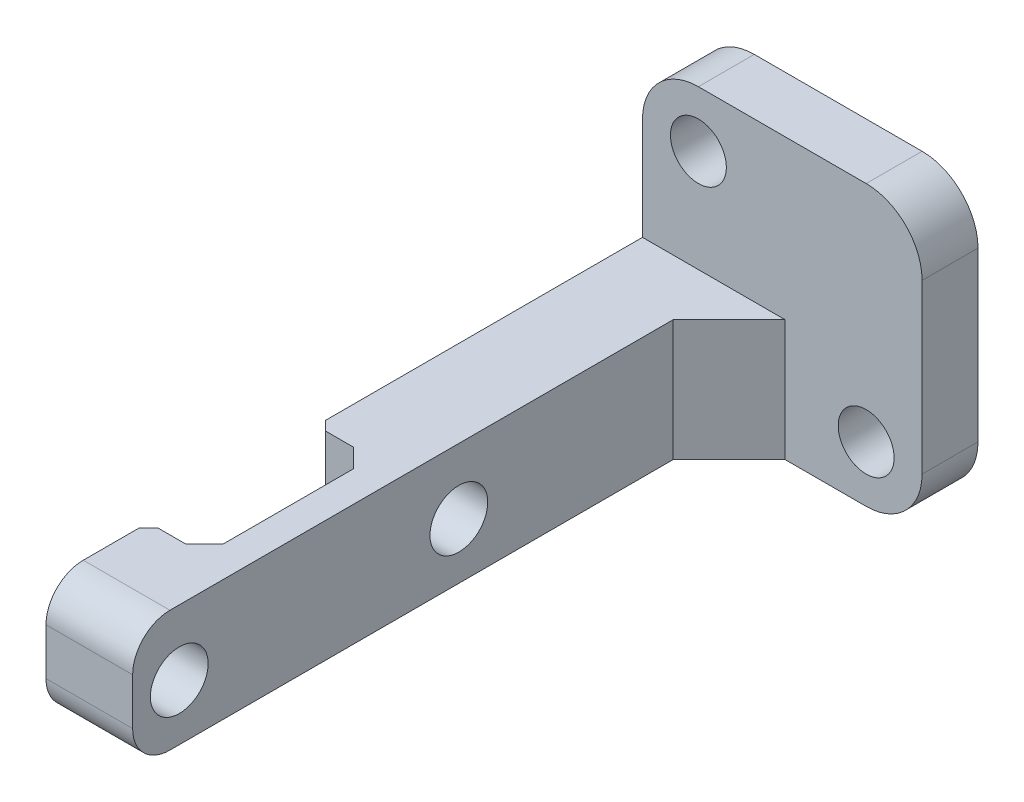
from build123d import *

# Parameters (mm, degrees)
SKETCH1_W           = 28
SKETCH1_H           = 5
BOSS_EXTRUDE1_DEPTH = 20
CHAMFER1_SIZE       = 15
BOSS_EXTRUDE2_DEPTH = 28
SKETCH3_W           = 3
SKETCH3_H           = 9
CUT_EXTRUDE1_DEPTH  = 12.8
CHAMFER2_SIZE       = 1
FILLET1_R           = 2
CHAMFER3_SIZE       = 0.5
CUT_EXTRUDE2_DEPTH  = 12.8
CHAMFER4_SIZE       = 3
CHAMFER5_SIZE       = 3
SKETCH8_W           = 3.20799886
SKETCH8_H           = 3.210000155
SKETCH8_W_2         = 3.209995615
SKETCH8_H_2         = 3.268000248
CUT_EXTRUDE3_DEPTH  = 5.4
SKETCH9_W           = 136.063633216
SKETCH9_H           = 34.178471192
CUT_EXTRUDE4_DEPTH  = 8
SKETCH10_W          = 4.648757297
SKETCH10_H          = 6.5
BOSS_EXTRUDE3_DEPTH = 10
SKETCH12_W          = 15
SKETCH12_H          = 15
BOSS_EXTRUDE4_DEPTH = 3
SKETCH13_R          = 1.5
CUT_EXTRUDE5_DEPTH  = 5
FILLET2_R           = 3
CHAMFER6_SIZE       = 3


with BuildPart() as part:
    # Sketch1 → Boss-Extrude1 (new body)
    with BuildSketch(Plane(origin=(0, 0, 0), x_dir=(1, 0, 0), z_dir=(0, 1, 0))):
        with Locations((14, 2.5)):
            Rectangle(SKETCH1_W, SKETCH1_H)
    extrude(amount=BOSS_EXTRUDE1_DEPTH)

    # Chamfer1
    chamfer1_edges = [part.edges().sort_by_distance(p)[0] for p in [
        (28, 0, -2.5),
    ]]
    chamfer(chamfer1_edges, length=CHAMFER1_SIZE)

    # Sketch2 → Boss-Extrude2 (add)
    with BuildSketch(Plane.XY):
        Polygon((9.648757297, 6.5), (5, 6.5), (5, 2), (5, 0), (9.648757297, 0), align=None)
    extrude(amount=BOSS_EXTRUDE2_DEPTH)

    # Sketch3 → Cut-Extrude1 (cut)
    with BuildSketch(Plane.XZ):
        with Locations((6.5, 18)):
            Rectangle(SKETCH3_W, SKETCH3_H)
    extrude(amount=-CUT_EXTRUDE1_DEPTH, mode=Mode.SUBTRACT)

    # Chamfer2
    chamfer2_edges = [part.edges().sort_by_distance(p)[0] for p in [
        (8, 3.25, 22.5),
        (8, 3.25, 13.5),
    ]]
    chamfer(chamfer2_edges, length=CHAMFER2_SIZE)

    # Fillet1
    fillet1_edges = [part.edges().sort_by_distance(p)[0] for p in [
        (7.324378649, 6.5, 28),
        (7.324378649, 0, 28),
    ]]
    fillet(fillet1_edges, radius=FILLET1_R)

    # Chamfer3
    chamfer3_edges = [part.edges().sort_by_distance(p)[0] for p in [
        (5, 3.25, 13.5),
        (5, 3.25, 22.5),
    ]]
    chamfer(chamfer3_edges, length=CHAMFER3_SIZE)

    # Sketch4 → Cut-Extrude2 (cut)
    with BuildSketch(Plane.ZY.offset(-5)):
        with BuildLine():
            ThreePointArc((25.5, 1.45), (27.05, 3), (25.5, 4.55))
            ThreePointArc((25.5, 4.55), (23.95, 3), (25.5, 1.45))
        make_face()
        with BuildLine():
            ThreePointArc((10.5, 4.55), (8.95, 3), (10.5, 1.45))
            ThreePointArc((10.5, 1.45), (12.05, 3), (10.5, 4.55))
        make_face()
    extrude(amount=-CUT_EXTRUDE2_DEPTH, mode=Mode.SUBTRACT)

    # Chamfer4
    chamfer4_edges = [part.edges().sort_by_distance(p)[0] for p in [
        (5, 3.25, 0),
        (9.648757297, 3.25, 0),
    ]]
    chamfer(chamfer4_edges, length=CHAMFER4_SIZE)

    # Chamfer5
    chamfer5_edges = [part.edges().sort_by_distance(p)[0] for p in [
        (7.324378649, 6.5, 0),
    ]]
    chamfer(chamfer5_edges, length=CHAMFER5_SIZE)

    # Sketch8 → Cut-Extrude3 (cut)
    # profile 1 of 4: a face of its own
    with BuildSketch(Plane(origin=(0, 20, 0), x_dir=(1, 0, 0), z_dir=(0, 1, 0))):
        with Locations((5.668003112, 2.226999903)):
            Rectangle(SKETCH8_W, SKETCH8_H)
        Polygon((7.122002542, 3.68199998), (6.328001618, 3.68199998), (4.214003682, 3.68199998), (4.214003682, 2.801999915), (4.214003682, 2.091999864), (4.214003682, 0.771999825), (4.858002067, 0.771999825), (6.60200417, 0.771999825), (7.122002542, 0.771999825), (7.122002542, 3.48399987), align=None, mode=Mode.SUBTRACT)
    # profile 2 of 4: a face of its own
    with BuildSketch(Plane(origin=(0, 20, 0), x_dir=(1, 0, 0), z_dir=(0, 1, 0))):
        Polygon((7.122002542, 3.68199998), (7.122002542, 3.48399987), (7.122002542, 0.771999825), (6.60200417, 0.771999825), (4.858002067, 0.771999825), (4.214003682, 0.771999825), (4.214003682, 2.091999864), (4.214003682, 2.801999915), (4.214003682, 3.68199998), (6.328001618, 3.68199998), align=None)
    # profile 3 of 4: a face of its own
    with BuildSketch(Plane(origin=(0, 20, 0), x_dir=(1, 0, 0), z_dir=(0, 1, 0))):
        with Locations((23.709002883, 2.229999751)):
            Rectangle(SKETCH8_W_2, SKETCH8_H_2)
        Polygon((22.254005075, 1.15799997), (22.254005075, 1.283999765), (22.254005075, 3.713999875), (25.16400069, 3.713999875), (25.16400069, 0.749999657), (25.16400069, 0.745999627), (24.429999292, 0.745999627), (22.254005075, 0.745999627), align=None, mode=Mode.SUBTRACT)
    # profile 4 of 4: a face of its own
    with BuildSketch(Plane(origin=(0, 20, 0), x_dir=(1, 0, 0), z_dir=(0, 1, 0))):
        Polygon((22.254005075, 3.713999875), (22.254005075, 1.283999765), (22.254005075, 1.15799997), (22.254005075, 0.745999627), (24.429999292, 0.745999627), (25.16400069, 0.745999627), (25.16400069, 0.749999657), (25.16400069, 3.713999875), align=None)
    extrude(amount=-CUT_EXTRUDE3_DEPTH, mode=Mode.SUBTRACT)

    # Sketch9 → Cut-Extrude4 (cut)
    with BuildSketch(Plane(origin=(0, 0, -5), x_dir=(-1, 0, 0), z_dir=(0, 0, -1))):
        with Locations((-4.69867378, 12.292617934)):
            Rectangle(SKETCH9_W, SKETCH9_H)
    extrude(amount=-CUT_EXTRUDE4_DEPTH, mode=Mode.SUBTRACT)

    # Sketch10 → Boss-Extrude3 (add)
    with BuildSketch(Plane(origin=(0, 0, 3), x_dir=(-1, 0, 0), z_dir=(0, 0, -1))):
        with Locations((-7.324378649, 3.25)):
            Rectangle(SKETCH10_W, SKETCH10_H)
    extrude(amount=BOSS_EXTRUDE3_DEPTH)

    # Sketch12 → Boss-Extrude4 (add)
    with BuildSketch(Plane(origin=(0, 0, -7), x_dir=(-1, 0, 0), z_dir=(0, 0, -1))):
        with Locations((-12.5, 7.5)):
            Rectangle(SKETCH12_W, SKETCH12_H)
    extrude(amount=-BOSS_EXTRUDE4_DEPTH)

    # Sketch13 → Cut-Extrude5 (cut)
    with BuildSketch(Plane.XY.offset(-4)):
        with Locations((17, 3)):
            Circle(SKETCH13_R)
        with Locations((8, 12)):
            Circle(SKETCH13_R)
    extrude(amount=-CUT_EXTRUDE5_DEPTH, mode=Mode.SUBTRACT)

    # Fillet2
    fillet2_edges = [part.edges().sort_by_distance(p)[0] for p in [
        (5, 15, -5.5),
        (20, 0, -5.5),
        (20, 15, -5.5),
    ]]
    fillet(fillet2_edges, radius=FILLET2_R)

    # Chamfer6
    chamfer6_edges = [part.edges().sort_by_distance(p)[0] for p in [
        (9.648757297, 3.25, -4),
    ]]
    chamfer(chamfer6_edges, length=CHAMFER6_SIZE)


solid = part.part
